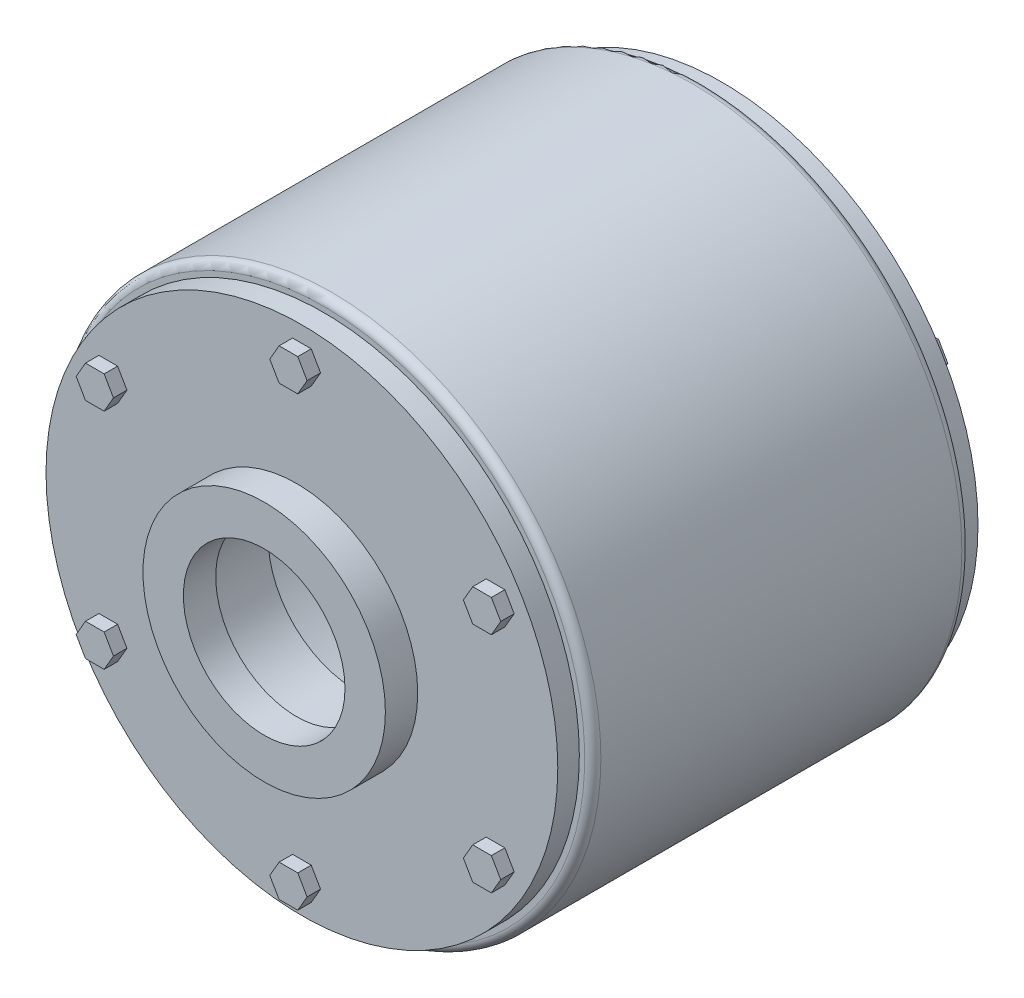
from build123d import *

# Parameters (mm, degrees)
SKETCH_2_R               = 70
SKETCH_2_R_2             = 57
EXTRUDE_1_DEPTH          = 12
SKETCH_3_R               = 57
SKETCH_3_R_2             = 40
EXTRUDE_2_DEPTH          = 7
EXTRUDE_START            = 8
SKETCH_4_R               = 95
SKETCH_4_R_2             = 40
EXTRUDE_3_DEPTH          = 8
EXTRUDE_4_DEPTH          = 5
PATTERN_CIRCULAR_2_COUNT = 6
FILLET_1_R               = 3
SKETCH_6_R               = 40
SKETCH_6_R_2             = 32.5
EXTRUDE_5_DEPTH          = 22
SKETCH_7_R               = 45
SKETCH_7_R_2             = 30
EXTRUDE_6_DEPTH          = 12


with BuildPart() as part:
    # 草图1 → 旋转2 (revolve)
    with BuildSketch(Plane(origin=(0, 0, 0), x_dir=(0, 0, -1), z_dir=(1, 0, 0)), mode=Mode.PRIVATE) as revolve_2_sk:
        Polygon((-70, 100), (0, 100), (0, 58), (-9.5, 58), (-9.5, 70), (-70, 70), align=None)
    revolve(revolve_2_sk.sketch.rotate(Axis((0, 0, 1000), (0, 0, -1)), 90), axis=Axis((0, 0, 1000), (0, 0, -1)))



with BuildPart() as body_2:
    # 草图2 → 凸台-拉伸1 (new body)
    with BuildSketch(Plane.XY.offset(70)):
        Circle(SKETCH_2_R)
        Circle(SKETCH_2_R_2, mode=Mode.SUBTRACT)
    extrude(amount=-EXTRUDE_1_DEPTH)


with BuildPart() as part_1:
    add(part.part)

    add(body_2.part)  # 凸台-拉伸2 merges body 2
    # 草图3 → 凸台-拉伸2 (add)
    with BuildSketch(Plane.XY.offset(70)):
        Circle(SKETCH_3_R)
        Circle(SKETCH_3_R_2, mode=Mode.SUBTRACT)
    extrude(amount=-EXTRUDE_2_DEPTH)

    # 草图4 → 凸台-拉伸3 (add)
    with BuildSketch(Plane.XY.offset(70).offset(EXTRUDE_START)):
        with Locations(Location((0, 0, 0), (0, 0, 180))):
            Circle(SKETCH_4_R)
        Circle(SKETCH_4_R_2, mode=Mode.SUBTRACT)
    extrude(amount=-EXTRUDE_3_DEPTH)

    # 草图5 → 凸台-拉伸4 (add)
    with BuildSketch(Plane.XY.offset(78)):
        Polygon((3.464101615, 77), (6.92820323, 83), (3.464101615, 89), (-3.464101615, 89), (-6.92820323, 83), (-3.464101615, 77), align=None)
    extrude_4 = extrude(amount=EXTRUDE_4_DEPTH)

    # 阵列(圆周)2: 凸台-拉伸4 ×6 about axis
    pattern_circular_2_axis = Axis((0, 0, 0), (0, 0, 1))
    for i in range(1, PATTERN_CIRCULAR_2_COUNT):
        add(extrude_4.rotate(pattern_circular_2_axis, i * 360 / PATTERN_CIRCULAR_2_COUNT))

    # 圆角1
    fillet_1_edges = [part_1.edges().sort_by_distance(p)[0] for p in [
        (-100, 0, 70),
    ]]
    fillet(fillet_1_edges, radius=FILLET_1_R)

    # 镜向8: part across plane


with BuildPart() as part_2:
    add(part_1.part)
    add(part_1.part.mirror(Plane(origin=(0, 100, 0), x_dir=(1, 0, 0), z_dir=(0, 0, 1))))

    # 草图6 → 凸台-拉伸5 (add)
    with BuildSketch(Plane.XY.offset(80)):
        Circle(SKETCH_6_R)
        Circle(SKETCH_6_R_2, mode=Mode.SUBTRACT)
    extrude(amount=-EXTRUDE_5_DEPTH)

    # 草图7 → 凸台-拉伸6 (add)
    with BuildSketch(Plane.XY.offset(80)):
        Circle(SKETCH_7_R)
        Circle(SKETCH_7_R_2, mode=Mode.SUBTRACT)
    extrude(amount=EXTRUDE_6_DEPTH)


solid = part_2.part
